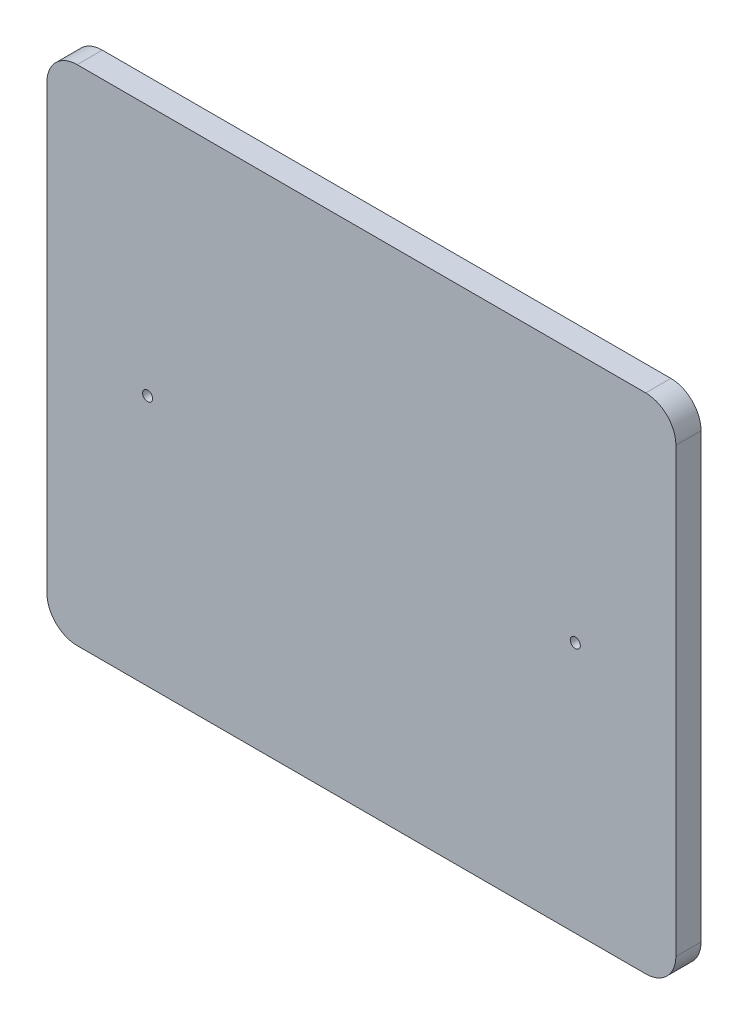
from build123d import *

# Parameters (mm, degrees)
SALIENTE_EXTRUIR1_DEPTH = 10
CROQUIS2_R              = 2
CORTAR_EXTRUIR1_DEPTH   = 10


with BuildPart() as part:
    # Croquis1 → Saliente-Extruir1 (new body)
    with BuildSketch(Plane.XY):
        with BuildLine():
            Line((113, -100), (-113, -100))
            ThreePointArc((-113, -100), (-121.485281374, -96.485281374), (-125, -88))
            Line((-125, -88), (-125, 88))
            ThreePointArc((-125, 88), (-121.485281374, 96.485281374), (-113, 100))
            Line((-113, 100), (113, 100))
            ThreePointArc((113, 100), (121.485281374, 96.485281374), (125, 88))
            Line((125, 88), (125, -88))
            ThreePointArc((125, -88), (121.485281374, -96.485281374), (113, -100))
        make_face()
    extrude(amount=SALIENTE_EXTRUIR1_DEPTH)

    # Croquis2 → Cortar-Extruir1 (cut)
    with BuildSketch(Plane.XY.offset(10)):
        with Locations((-85, 0)):
            Circle(CROQUIS2_R)
        with Locations(Location((85, 0, 0), (0, 0, 180))):
            Circle(CROQUIS2_R)
    extrude(amount=-CORTAR_EXTRUIR1_DEPTH, mode=Mode.SUBTRACT)


solid = part.part
